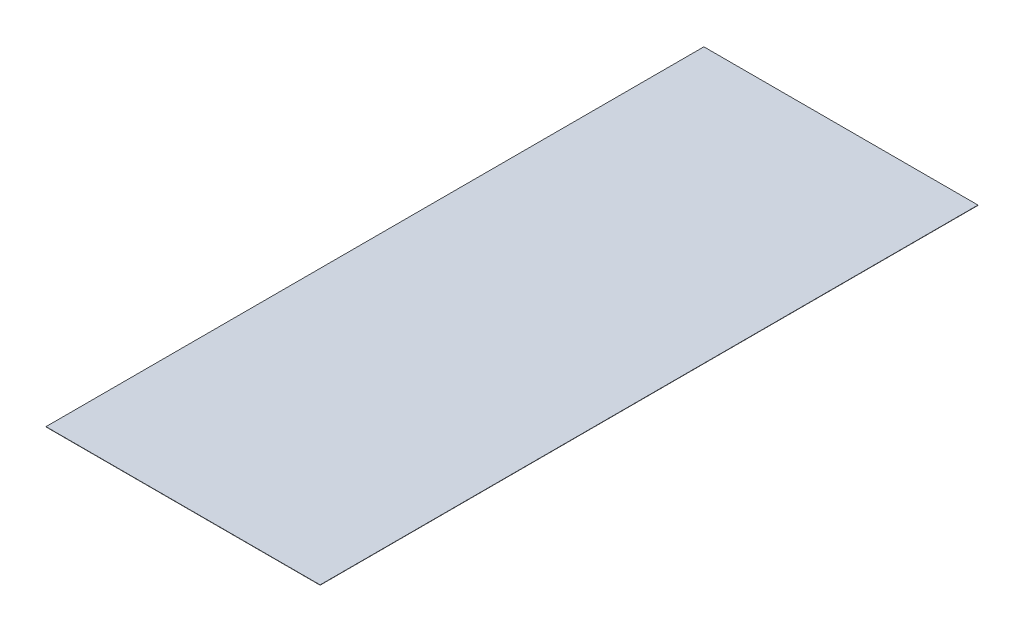
from build123d import *

# Parameters (mm, degrees)
SKETCH_1_W      = 1000
SKETCH_1_H      = 2400
EXTRUDE_1_DEPTH = 1


with BuildPart() as part:
    # Эскиз1 → Бобышка-Вытянуть1 (new body)
    with BuildSketch(Plane(origin=(0, 0, 0), x_dir=(1, 0, 0), z_dir=(0, 1, 0))):
        Rectangle(SKETCH_1_W, SKETCH_1_H)
    extrude(amount=EXTRUDE_1_DEPTH)


solid = part.part
